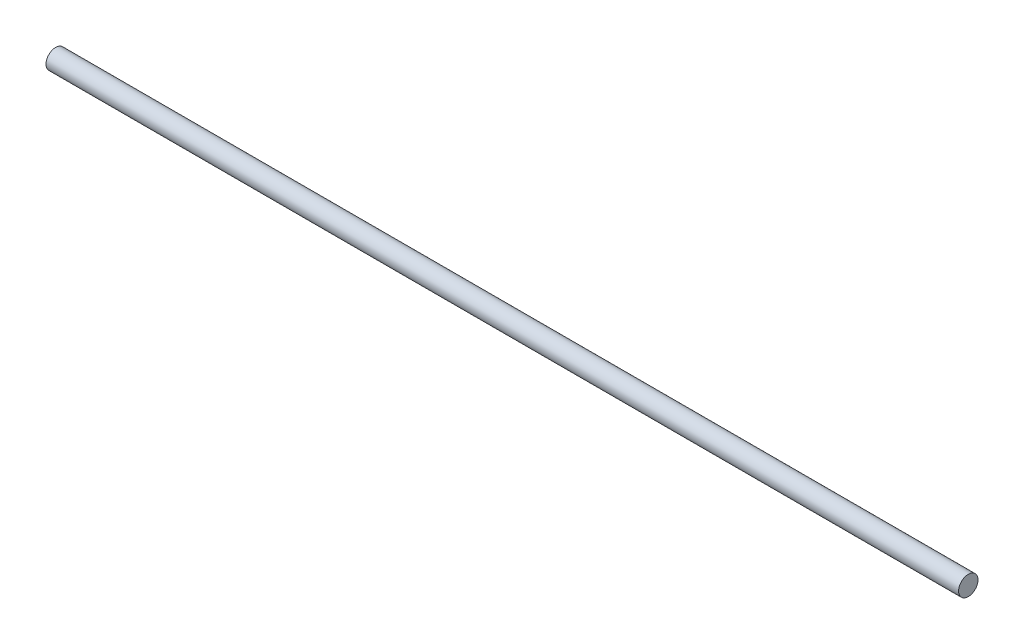
from build123d import *

# Parameters (mm, degrees)
SKETCH1_R           = 6.35
BOSS_EXTRUDE1_DEPTH = 596.9


with BuildPart() as part:
    # Sketch1 → Boss-Extrude1 (new body)
    with BuildSketch(Plane(origin=(0, 0, 0), x_dir=(0, 0, -1), z_dir=(1, 0, 0))):
        Circle(SKETCH1_R)
    extrude(amount=BOSS_EXTRUDE1_DEPTH)


solid = part.part
